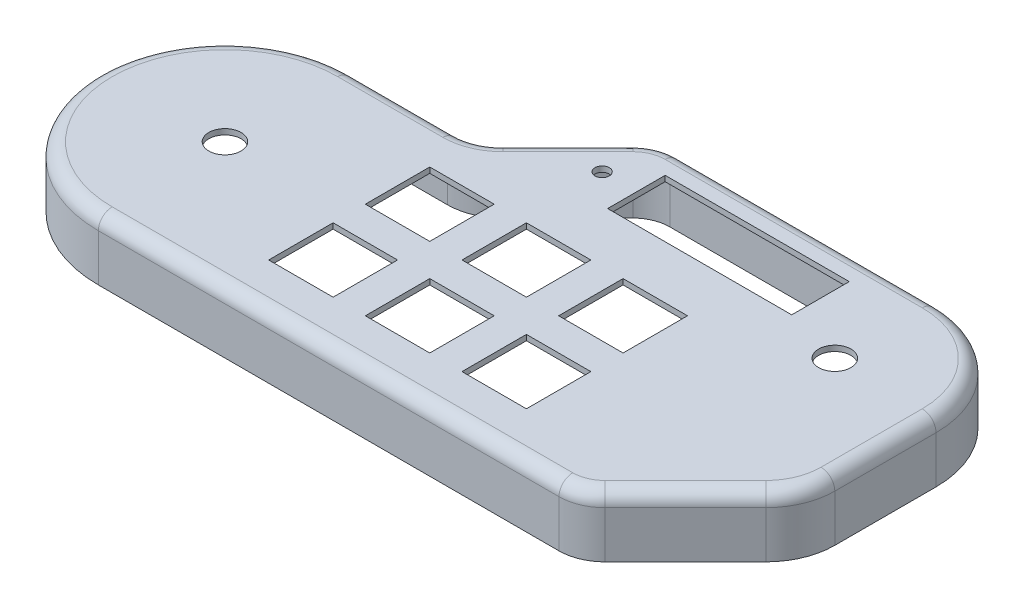
from build123d import *

# Parameters (mm, degrees)
SKETCH1_R           = 3.5
SKETCH1_W           = 14
SKETCH1_H           = 14
BOSS_EXTRUDE1_DEPTH = 1.2
FILLET1_R           = 10
BOSS_EXTRUDE2_DEPTH = 12
FILLET2_R           = 3
FILLET3_R           = 1
SKETCH4_R           = 1.5625
SKETCH4_W           = 40
SKETCH4_H           = 12.5
CUT_EXTRUDE1_DEPTH  = 171.515153338


with BuildPart() as part:
    # Sketch1 → Boss-Extrude1 (new body)
    with BuildSketch(Plane(origin=(0, 0, 0), x_dir=(1, 0, 0), z_dir=(0, 1, 0))):
        with BuildLine():
            Line((-125.065322034, 55), (-98.065322034, 55))
            Line((-98.065322034, 55), (-78.065322034, 75))
            Line((-78.065322034, 75), (-18.065322034, 75))
            ThreePointArc((-18.065322034, 75), (-2.508972848, 68.556349186), (3.934677966, 53))
            Line((3.934677966, 53), (3.934677966, 31))
            ThreePointArc((3.934677966, 31), (2.792870954, 25.259748515), (-0.458720316, 20.393398282))
            Line((-0.458720316, 20.393398282), (-20.852118598, 0))
            Line((-20.852118598, 0), (-25.734830863, 0))
            Line((-25.734830863, 0), (-125.065322034, 0))
            ThreePointArc((-125.065322034, 0), (-152.565322034, 27.5), (-125.065322034, 55))
        make_face()
        with Locations(Location((-125.065322034, 27.5, 0), (0, 0, 270))):
            Circle(SKETCH1_R, mode=Mode.SUBTRACT)
        with Locations(Location((-18.065322034, 53, 0), (0, 0, 270))):
            Circle(SKETCH1_R, mode=Mode.SUBTRACT)
        with Locations((-70.065322034, 17)):
            Rectangle(SKETCH1_W, SKETCH1_H, mode=Mode.SUBTRACT)
        with Locations((-91.065322034, 17)):
            Rectangle(SKETCH1_W, SKETCH1_H, mode=Mode.SUBTRACT)
        with Locations((-49.065322034, 17)):
            Rectangle(SKETCH1_W, SKETCH1_H, mode=Mode.SUBTRACT)
        with Locations((-70.065322034, 38)):
            Rectangle(SKETCH1_W, SKETCH1_H, mode=Mode.SUBTRACT)
        with Locations((-49.065322034, 38)):
            Rectangle(SKETCH1_W, SKETCH1_H, mode=Mode.SUBTRACT)
        with Locations((-91.065322034, 38)):
            Rectangle(SKETCH1_W, SKETCH1_H, mode=Mode.SUBTRACT)
    extrude(amount=BOSS_EXTRUDE1_DEPTH)

    # Fillet1
    fillet1_edges = [part.edges().sort_by_distance(p)[0] for p in [
        (-98.065322034, 0.6, -55),
        (-78.065322034, 0.6, -75),
        (-20.852118598, 0.6, 0),
    ]]
    fillet(fillet1_edges, radius=FILLET1_R)

    # Sketch3 → Boss-Extrude2 (add)
    with BuildSketch(Plane.XZ):
        with BuildLine():
            Line((-0.458720316, -20.393398282), (-17.92318641, -2.928932188))
            ThreePointArc((-17.92318641, -2.928932188), (-21.167419898, -0.761204675), (-24.994254222, 0))
            Line((-24.994254222, 0), (-125.065322034, 0))
            ThreePointArc((-125.065322034, 0), (-152.565322034, -27.5), (-125.065322034, -55))
            Line((-125.065322034, -55), (-102.207457658, -55))
            ThreePointArc((-102.207457658, -55), (-98.380623334, -55.761204675), (-95.136389846, -57.928932188))
            Line((-95.136389846, -57.928932188), (-80.994254222, -72.071067812))
            ThreePointArc((-80.994254222, -72.071067812), (-77.750020734, -74.238795325), (-73.92318641, -75))
            Line((-73.92318641, -75), (-18.065322034, -75))
            ThreePointArc((-18.065322034, -75), (-2.508972848, -68.556349186), (3.934677966, -53))
            Line((3.934677966, -53), (3.934677966, -31))
            ThreePointArc((3.934677966, -31), (2.792870954, -25.259748515), (-0.458720316, -20.393398282))
        make_face()
        with BuildLine():
            Line((-1.872933878, -21.807611845), (-19.337399973, -4.343145751))
            ThreePointArc((-19.337399973, -4.343145751), (-21.932786763, -2.60896374), (-24.994254222, -2))
            Line((-24.994254222, -2), (-125.065322034, -2))
            ThreePointArc((-125.065322034, -2), (-150.565322034, -27.5), (-125.065322034, -53))
            Line((-125.065322034, -53), (-102.207457658, -53))
            ThreePointArc((-102.207457658, -53), (-97.615256469, -53.91344561), (-93.722176283, -56.514718626))
            Line((-93.722176283, -56.514718626), (-79.58004066, -70.656854249))
            ThreePointArc((-79.58004066, -70.656854249), (-76.984653869, -72.39103626), (-73.92318641, -73))
            Line((-73.92318641, -73), (-18.065322034, -73))
            ThreePointArc((-18.065322034, -73), (-3.92318641, -67.142135624), (1.934677966, -53))
            Line((1.934677966, -53), (1.934677966, -31))
            ThreePointArc((1.934677966, -31), (0.945111889, -26.025115379), (-1.872933878, -21.807611845))
        make_face(mode=Mode.SUBTRACT)
    extrude(amount=BOSS_EXTRUDE2_DEPTH)

    # Fillet2
    fillet2_edges = [part.edges().sort_by_distance(p)[0] for p in [
        (-9.190953363, 1.2, -11.661165235),
        (-88.065322034, 1.2, -65),
        (-113.636389846, 1.2, -55),
        (-77.750020734, 1.2, -74.238795325),
        (-21.167419898, 1.2, -0.761204675),
        (-98.380623334, 1.2, -55.761204675),
        (2.792870954, 1.2, -25.259748515),
        (3.934677966, 1.2, -42),
        (-2.508972848, 1.2, -68.556349186),
        (-45.994254222, 1.2, -75),
        (-152.565322034, 1.2, -27.5),
        (-75.029788128, 1.2, 0),
    ]]
    fillet(fillet2_edges, radius=FILLET2_R)

    # Fillet3
    fillet3_edges = [part.edges().sort_by_distance(p)[0] for p in [
        (-97.615256469, 0, -53.91344561),
        (0.945111889, 0, -26.025115379),
        (-10.605166926, 0, -13.075378798),
        (-21.932786763, 0, -2.60896374),
        (-75.029788128, 0, -2),
        (-150.565322034, 0, -27.5),
        (-113.636389846, 0, -53),
        (-86.651108472, 0, -63.585786438),
        (-76.984653869, 0, -72.39103626),
        (-45.994254222, 0, -73),
        (-3.92318641, 0, -67.142135624),
        (1.934677966, 0, -42),
    ]]
    fillet(fillet3_edges, radius=FILLET3_R)

    # Sketch4 → Cut-Extrude1 (cut, through all)
    with BuildSketch(Plane(origin=(0, 1.2, 0), x_dir=(1, 0, 0), z_dir=(0, 1, 0))):
        with Locations(Location((-78.43359405, 62.814339828, 0), (0, 0, 270))):
            Circle(SKETCH4_R)
        with Locations((-50.92318641, 62.75)):
            Rectangle(SKETCH4_W, SKETCH4_H)
    extrude(amount=-CUT_EXTRUDE1_DEPTH, mode=Mode.SUBTRACT)


solid = part.part
